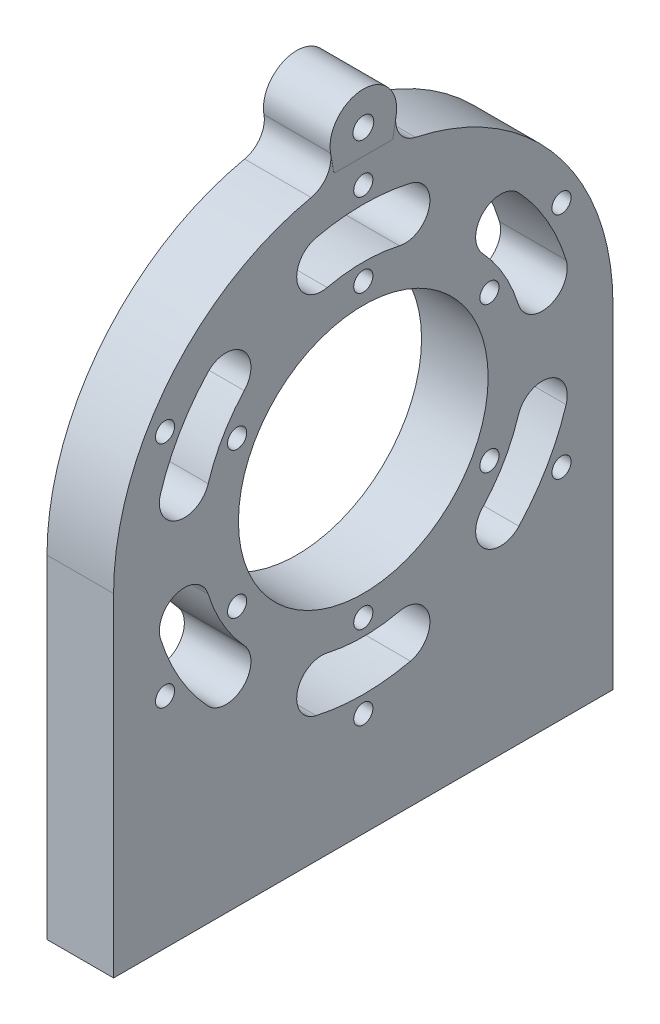
from build123d import *

# Parameters (mm, degrees)
SKETCH_1_R             = 1.15
SKETCH_1_R_2           = 15
SKETCH_1_R_3           = 1.25
EXTRUDE_1_DEPTH        = 4
HOLE_WIZARD_M3_1_D     = 2.5
HOLE_WIZARD_M3_1_DEPTH = 7.5
HOLE_WIZARD_M3_1_TIP   = 0.751075774
SKETCH1_R              = 1.25
BOSS_EXTRUDE1_DEPTH    = 0.01
SKETCH1_2_R            = 1.25
BOSS_EXTRUDE2_DEPTH    = 0.01


with BuildPart() as part:
    # 草图1 → 凸台-拉伸1 (new, symmetric)
    with BuildSketch(Plane(origin=(0, 0, 0), x_dir=(0, 0, -1), z_dir=(1, 0, 0))):
        with BuildLine():
            Line((30, -40), (30, 0))
            ThreePointArc((30, 0), (23.323275812, 18.868619595), (6.265012972, 29.3385346))
            ThreePointArc((6.265012972, 29.3385346), (4.402143602, 30.598161767), (3.938008154, 32.798507463))
            ThreePointArc((3.938008154, 32.798507463), (0, 37.5), (-3.938008154, 32.798507463))
            ThreePointArc((-3.938008154, 32.798507463), (-4.402143602, 30.598161767), (-6.265012972, 29.3385346))
            ThreePointArc((-6.265012972, 29.3385346), (-23.323275812, 18.868619595), (-30, 0))
            Line((-30, 0), (-30, -40))
            Line((-30, -40), (30, -40))
        make_face()
        with BuildLine():
            ThreePointArc((4.333333333, 19.012422839), (0, 19.5), (-4.333333333, 19.012422839))
            ThreePointArc((-4.333333333, 19.012422839), (-7.924988129, 21.270744302), (-5.666666667, 24.862399098))
            ThreePointArc((-5.666666667, 24.862399098), (0, 25.5), (5.666666667, 24.862399098))
            ThreePointArc((5.666666667, 24.862399098), (7.924988129, 21.270744302), (4.333333333, 19.012422839))
        make_face(mode=Mode.SUBTRACT)
        with BuildLine():
            ThreePointArc((-5.666666667, -24.862399098), (-7.924988129, -21.270744302), (-4.333333333, -19.012422839))
            ThreePointArc((-4.333333333, -19.012422839), (0, -19.5), (4.333333333, -19.012422839))
            ThreePointArc((4.333333333, -19.012422839), (7.924988129, -21.270744302), (5.666666667, -24.862399098))
            ThreePointArc((5.666666667, -24.862399098), (0, -25.5), (-5.666666667, -24.862399098))
        make_face(mode=Mode.SUBTRACT)
        with Locations((-23.815698604, -13.75)):
            Circle(SKETCH_1_R, mode=Mode.SUBTRACT)
        with BuildLine():
            ThreePointArc((-24.364802551, -7.523722261), (-22.383498987, -3.772131106), (-18.631907833, -5.75343467))
            ThreePointArc((-18.631907833, -5.75343467), (-16.887495374, -9.75), (-14.2985745, -13.258988169))
            ThreePointArc((-14.2985745, -13.258988169), (-14.458510858, -17.498613195), (-18.698135884, -17.338676837))
            ThreePointArc((-18.698135884, -17.338676837), (-22.083647797, -12.75), (-24.364802551, -7.523722261))
        make_face(mode=Mode.SUBTRACT)
        with Locations((-15.155444566, -8.75)):
            Circle(SKETCH_1_R, mode=Mode.SUBTRACT)
        with Locations((0, -27.5)):
            Circle(SKETCH_1_R, mode=Mode.SUBTRACT)
        with Locations((0, -17.5)):
            Circle(SKETCH_1_R, mode=Mode.SUBTRACT)
        with BuildLine():
            ThreePointArc((18.631907833, -5.75343467), (22.383498987, -3.772131106), (24.364802551, -7.523722261))
            ThreePointArc((24.364802551, -7.523722261), (22.083647797, -12.75), (18.698135884, -17.338676837))
            ThreePointArc((18.698135884, -17.338676837), (14.458510858, -17.498613195), (14.2985745, -13.258988169))
            ThreePointArc((14.2985745, -13.258988169), (16.887495374, -9.75), (18.631907833, -5.75343467))
        make_face(mode=Mode.SUBTRACT)
        with Locations((23.815698604, -13.75)):
            Circle(SKETCH_1_R, mode=Mode.SUBTRACT)
        with Locations((15.155444566, -8.75)):
            Circle(SKETCH_1_R, mode=Mode.SUBTRACT)
        with Locations((-23.815698604, 13.75)):
            Circle(SKETCH_1_R, mode=Mode.SUBTRACT)
        with BuildLine():
            ThreePointArc((-18.698135884, 17.338676837), (-14.458510858, 17.498613195), (-14.2985745, 13.258988169))
            ThreePointArc((-14.2985745, 13.258988169), (-16.887495374, 9.75), (-18.631907833, 5.75343467))
            ThreePointArc((-18.631907833, 5.75343467), (-22.383498987, 3.772131106), (-24.364802551, 7.523722261))
            ThreePointArc((-24.364802551, 7.523722261), (-22.083647797, 12.75), (-18.698135884, 17.338676837))
        make_face(mode=Mode.SUBTRACT)
        with Locations((-15.155444566, 8.75)):
            Circle(SKETCH_1_R, mode=Mode.SUBTRACT)
        Circle(SKETCH_1_R_2, mode=Mode.SUBTRACT)
        with Locations((0, 17.5)):
            Circle(SKETCH_1_R, mode=Mode.SUBTRACT)
        with Locations((0, 27.5)):
            Circle(SKETCH_1_R, mode=Mode.SUBTRACT)
        with Locations((0, 33.5)):
            Circle(SKETCH_1_R_3, mode=Mode.SUBTRACT)
        with Locations((15.155444566, 8.75)):
            Circle(SKETCH_1_R, mode=Mode.SUBTRACT)
        with BuildLine():
            ThreePointArc((24.364802551, 7.523722261), (22.383498987, 3.772131106), (18.631907833, 5.75343467))
            ThreePointArc((18.631907833, 5.75343467), (16.887495374, 9.75), (14.2985745, 13.258988169))
            ThreePointArc((14.2985745, 13.258988169), (14.458510858, 17.498613195), (18.698135884, 17.338676837))
            ThreePointArc((18.698135884, 17.338676837), (22.083647797, 12.75), (24.364802551, 7.523722261))
        make_face(mode=Mode.SUBTRACT)
        with Locations((23.815698604, 13.75)):
            Circle(SKETCH_1_R, mode=Mode.SUBTRACT)
    extrude(amount=EXTRUDE_1_DEPTH, both=True)

    # M3 螺纹孔1
    with Locations(Plane(origin=(0, -40, 22.5), x_dir=(0, 0, -1), z_dir=(0, -1, 0))):
        with Locations((0, 0), (22.5, 0), (45, 0)):
            Hole(HOLE_WIZARD_M3_1_D / 2, depth=HOLE_WIZARD_M3_1_DEPTH)
            with Locations((0, 0, -(HOLE_WIZARD_M3_1_DEPTH + HOLE_WIZARD_M3_1_TIP / 2))):  # 118° drill point
                Cone(0, HOLE_WIZARD_M3_1_D / 2, HOLE_WIZARD_M3_1_TIP, mode=Mode.SUBTRACT)

    # Sketch1 → Boss-Extrude1 (add)
    with BuildSketch(Plane(origin=(4, 0, 0), x_dir=(0, 0, -1), z_dir=(1, 0, 0))):
        with BuildLine():
            Line((-3.938008154, 32.798507463), (-3.526843322, 30.490328295))
            Line((-3.526843322, 30.490328295), (3.526843322, 30.490328295))
            Line((3.526843322, 30.490328295), (3.938008154, 32.798507463))
            ThreePointArc((3.938008154, 32.798507463), (0, 37.5), (-3.938008154, 32.798507463))
        make_face()
        with Locations((0, 33.5)):
            Circle(SKETCH1_R, mode=Mode.SUBTRACT)
    extrude(amount=BOSS_EXTRUDE1_DEPTH)

    # Sketch1<2> → Boss-Extrude2 (add)
    with BuildSketch(Plane(origin=(4, 0, 0), x_dir=(0, 0, -1), z_dir=(1, 0, 0))):
        with BuildLine():
            Line((-3.938008154, 32.798507463), (-3.526843322, 30.490328295))
            Line((-3.526843322, 30.490328295), (3.526843322, 30.490328295))
            Line((3.526843322, 30.490328295), (3.938008154, 32.798507463))
            ThreePointArc((3.938008154, 32.798507463), (0, 37.5), (-3.938008154, 32.798507463))
        make_face()
        with Locations((0, 33.5)):
            Circle(SKETCH1_2_R, mode=Mode.SUBTRACT)
    extrude(amount=BOSS_EXTRUDE2_DEPTH)


solid = part.part
